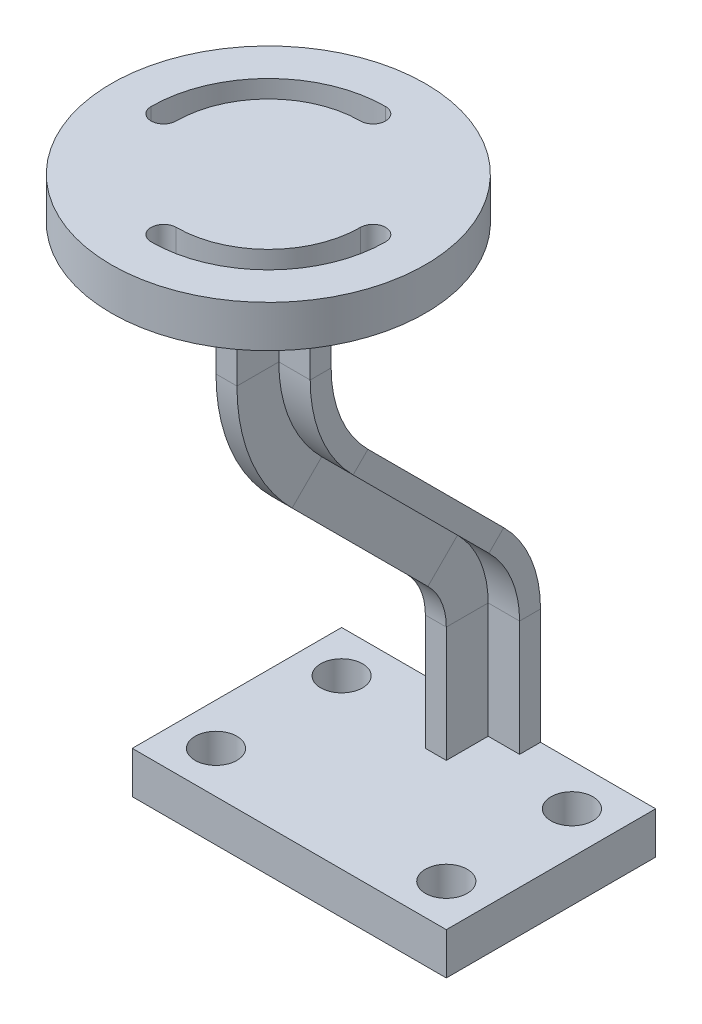
from build123d import *

# Parameters (mm, degrees)
SKETCH1_W           = 150
SKETCH1_H           = 100
SKETCH1_R           = 10
BOSS_EXTRUDE1_DEPTH = 20
SKETCH6_R           = 75
BOSS_EXTRUDE2_DEPTH = 20


with BuildPart() as part:
    # Sketch1 → Boss-Extrude1 (new body)
    with BuildSketch(Plane(origin=(0, 0, 0), x_dir=(1, 0, 0), z_dir=(0, 1, 0))):
        with Locations((-11.72985782, -7.612559242)):
            Rectangle(SKETCH1_W, SKETCH1_H)
        with Locations(Location((43.27014218, -37.612559242, 0), (0, 0, 270))):
            Circle(SKETCH1_R, mode=Mode.SUBTRACT)
        with Locations(Location((43.27014218, 22.387440758, 0), (0, 0, 270))):
            Circle(SKETCH1_R, mode=Mode.SUBTRACT)
        with Locations(Location((-66.72985782, 22.387440758, 0), (0, 0, 270))):
            Circle(SKETCH1_R, mode=Mode.SUBTRACT)
        with Locations(Location((-66.72985782, -37.612559242, 0), (0, 0, 270))):
            Circle(SKETCH1_R, mode=Mode.SUBTRACT)
    extrude(amount=BOSS_EXTRUDE1_DEPTH)

    # Sweep1: sweep along a path in Sketch4
    with BuildLine(Plane.ZY.offset(11.72985782)) as sweep1_path:
        Line((-42.387440758, 20), (-42.387440758, 75.147186258))
        ThreePointArc((-42.387440758, 75.147186258), (-37.820212709, 98.1081922), (-24.813847629, 117.573593129))
        Line((-24.813847629, 117.573593129), (40.038966113, 182.426406871))
        ThreePointArc((40.038966113, 182.426406871), (53.045331192, 201.8918078), (57.612559242, 224.852813742))
        Line((57.612559242, 224.852813742), (57.612559242, 280))
    # Sketch5 → Sweep1 (sweep)
    with BuildSketch(Plane(origin=(0, 20, 0), x_dir=(1, 0, 0), z_dir=(0, 1, 0))):
        Polygon((-31.72985782, 42.387440758), (8.27014218, 42.387440758), (8.27014218, 32.387440758), (-6.72985782, 32.387440758), (-6.72985782, 12.387440758), (-16.72985782, 12.387440758), (-16.72985782, 32.387440758), (-31.72985782, 32.387440758), align=None)
    sweep(path=sweep1_path.line)

    # Sketch6 → Boss-Extrude2 (add)
    with BuildSketch(Plane(origin=(0, 280, 0), x_dir=(1, 0, 0), z_dir=(0, 1, 0))):
        with Locations(Location((-11.72985782, -67.612559242, 0), (0, 0, 270))):
            Circle(SKETCH6_R)
        with BuildLine():
            ThreePointArc((-11.72985782, -11.612559242), (-51.327837566, -28.014579495), (-67.72985782, -67.612559242))
            ThreePointArc((-67.72985782, -67.612559242), (-61.72985782, -73.612559242), (-55.72985782, -67.612559242))
            ThreePointArc((-55.72985782, -67.612559242), (-42.842556192, -36.499860869), (-11.72985782, -23.612559242))
            ThreePointArc((-11.72985782, -23.612559242), (-5.72985782, -17.612559242), (-11.72985782, -11.612559242))
        make_face(mode=Mode.SUBTRACT)
        with BuildLine():
            ThreePointArc((-11.72985782, -123.612559242), (27.868121927, -107.210538988), (44.27014218, -67.612559242))
            ThreePointArc((44.27014218, -67.612559242), (38.27014218, -61.612559242), (32.27014218, -67.612559242))
            ThreePointArc((32.27014218, -67.612559242), (19.382840552, -98.725257614), (-11.72985782, -111.612559242))
            ThreePointArc((-11.72985782, -111.612559242), (-17.72985782, -117.612559242), (-11.72985782, -123.612559242))
        make_face(mode=Mode.SUBTRACT)
    extrude(amount=BOSS_EXTRUDE2_DEPTH)


solid = part.part
